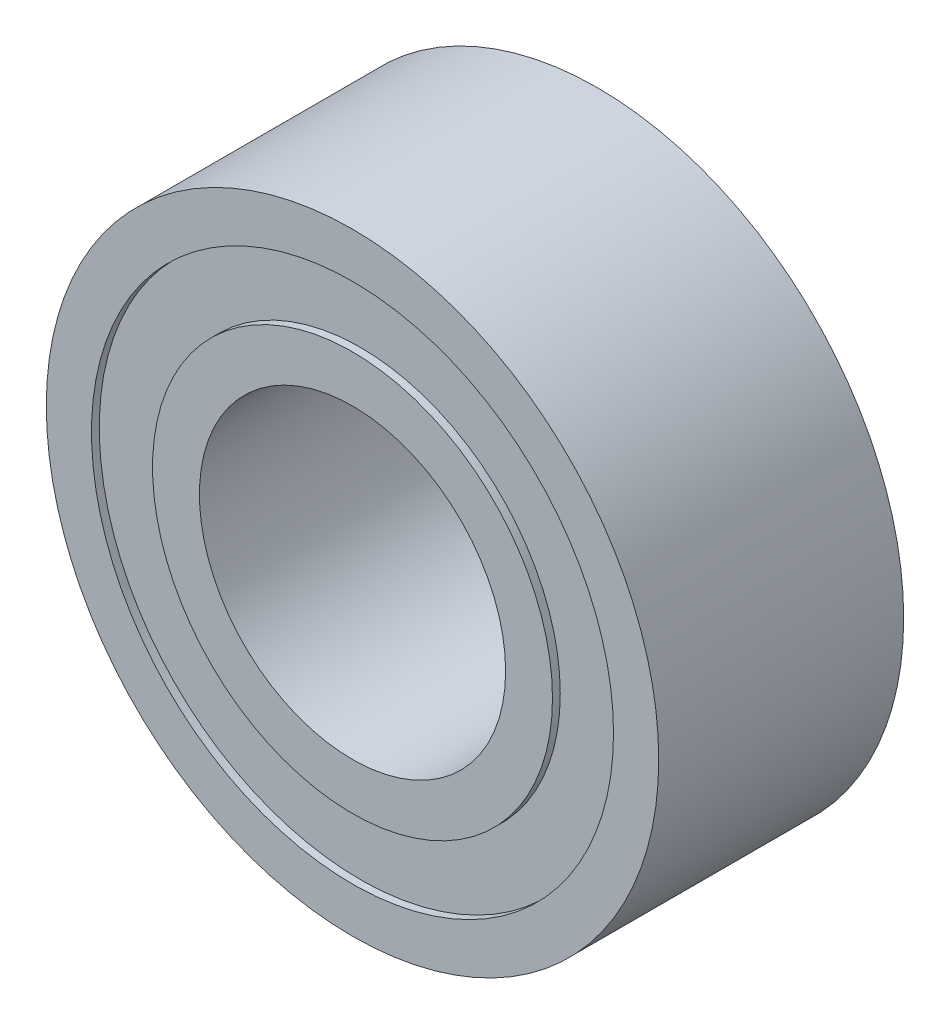
from build123d import *

# Parameters (mm, degrees)
SKETCH1_R           = 5
SKETCH1_R_2         = 2.5
BOSS_EXTRUDE1_DEPTH = 4
SKETCH2_R           = 4.261634863
SKETCH2_R_2         = 3.265328535
CUT_EXTRUDE1_DEPTH  = 0.127
CUT_EXTRUDE2_START  = -0.127
SKETCH3_R           = 4.261634863
SKETCH3_R_2         = 3.265328535
CUT_EXTRUDE2_DEPTH  = 0.127


with BuildPart() as part:
    # Sketch1 → Boss-Extrude1 (new body)
    with BuildSketch(Plane.XY):
        Circle(SKETCH1_R)
        Circle(SKETCH1_R_2, mode=Mode.SUBTRACT)
    extrude(amount=BOSS_EXTRUDE1_DEPTH)

    # Sketch2 → Cut-Extrude1 (cut)
    with BuildSketch(Plane.XY.offset(4)):
        Circle(SKETCH2_R)
        Circle(SKETCH2_R_2, mode=Mode.SUBTRACT)
    extrude(amount=-CUT_EXTRUDE1_DEPTH, mode=Mode.SUBTRACT)

    # Sketch3 → Cut-Extrude2 (cut)
    with BuildSketch(Plane(origin=(0, 0, 0), x_dir=(-1, 0, 0), z_dir=(0, 0, -1)).offset(CUT_EXTRUDE2_START)):
        with Locations(Location((0, 0, 0), (0, 0, 180))):
            Circle(SKETCH3_R)
        with Locations(Location((0, 0, 0), (0, 0, 180))):
            Circle(SKETCH3_R_2, mode=Mode.SUBTRACT)
    extrude(amount=CUT_EXTRUDE2_DEPTH, mode=Mode.SUBTRACT)


solid = part.part
